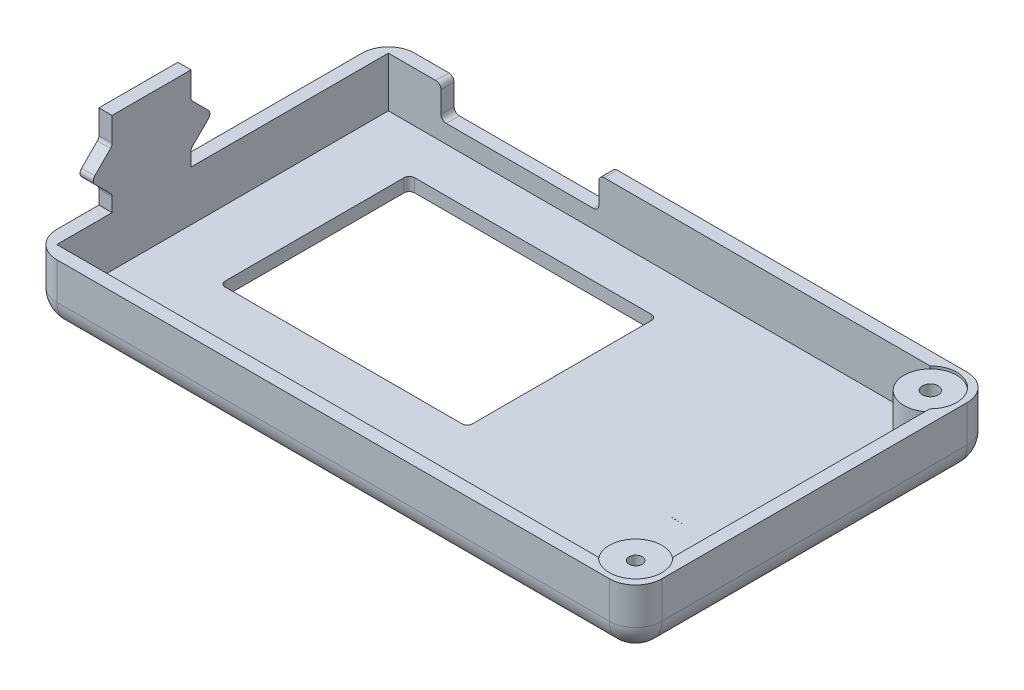
from build123d import *

# Parameters (mm, degrees)
SKETCH1_W           = 115
SKETCH1_H           = 68
BOSS_EXTRUDE1_DEPTH = 28
SHELL2_T            = -2.5
CUT_EXTRUDE8_DEPTH  = 124.146254511
CUT_EXTRUDE9_REACH  = 125.146
SKETCH10_W          = 26.217499217
SKETCH10_H          = 23
FILLET3_R           = 5
FILLET4_R           = 1
SKETCH11_R          = 5
BOSS_EXTRUDE3_DEPTH = 9.5
SKETCH12_R          = 5
CUT_EXTRUDE10_DEPTH = 0.5
SKETCH13_R          = 1.25
CUT_EXTRUDE11_DEPTH = 69.807703057
SKETCH15_R          = 1.5
CUT_EXTRUDE12_DEPTH = 69.80770319
CUT_EXTRUDE13_DEPTH = 73.431001776
SKETCH18_W          = 30
SKETCH18_H          = 6.061530508
CUT_EXTRUDE14_DEPTH = 2.5
FILLET5_R           = 1


with BuildPart() as part:
    # Sketch1 → Boss-Extrude1 (new body)
    with BuildSketch(Plane(origin=(0, 0, 0), x_dir=(1, 0, 0), z_dir=(0, 1, 0))):
        Rectangle(SKETCH1_W, SKETCH1_H)
    extrude(amount=BOSS_EXTRUDE1_DEPTH)

    # Shell2
    shell2_openings = [part.faces().sort_by_distance(p)[0] for p in [
        (0, 28, 0),
    ]]
    offset(amount=SHELL2_T, openings=shell2_openings, kind=Kind.INTERSECTION)

    # Sketch9 → Cut-Extrude8 (cut, through all)
    with BuildSketch(Plane.ZY.offset(57.5)):
        Polygon((-34, 12), (6, 12), (6, 15), (2, 19), (6, 23), (6, 28), (21, 28), (21, 23), (25, 19), (21, 15), (21, 12), (34, 12), (34, 34), (-34, 34), align=None)
    extrude(amount=-CUT_EXTRUDE8_DEPTH, mode=Mode.SUBTRACT)

    # Sketch10 → Cut-Extrude9 (cut, up to next)
    with BuildSketch(Plane(origin=(57.5, 0, 0), x_dir=(0, 0, -1), z_dir=(1, 0, 0)), mode=Mode.PRIVATE) as cut_extrude9_sk1:
        with Locations((-11.882996399, 23.5)):
            Rectangle(SKETCH10_W, SKETCH10_H)
    cut_extrude9_tool1 = extrude(cut_extrude9_sk1.sketch, amount=-CUT_EXTRUDE9_REACH, mode=Mode.PRIVATE) & part.part
    add(cut_extrude9_tool1.solids().sort_by_distance((57.5, 23.5, 11.882996))[0], mode=Mode.SUBTRACT)


with BuildPart() as cut_extrude9_piece_1:
    # of the separate pieces the step leaves, piece 1, a body of its own (cut_extrude9_pieces)
    add(part.part.solids().sort_by_distance((-57.5, 0, 34))[0])

    # Fillet3
    fillet3_edges = [cut_extrude9_piece_1.edges().sort_by_distance(p)[0] for p in [
        (57.5, 6, 34),
        (57.5, 0, 0),
        (57.5, 6, -34),
        (0, 0, -34),
        (-57.5, 6, -34),
        (-57.5, 0, 0),
        (-57.5, 6, 34),
        (0, 0, 34),
    ]]
    fillet(fillet3_edges, radius=FILLET3_R)

    # Fillet4
    fillet4_edges = [cut_extrude9_piece_1.edges().sort_by_distance(p)[0] for p in [
        (-56.25, 23, 21),
        (-56.25, 19, 25),
        (-56.25, 15, 21),
        (-56.25, 23, 6),
        (-56.25, 19, 2),
        (-56.25, 15, 6),
    ]]
    fillet(fillet4_edges, radius=FILLET4_R)

    # Sketch11 → Boss-Extrude3 (add)
    with BuildSketch(Plane(origin=(0, 2.5, 0), x_dir=(1, 0, 0), z_dir=(0, 1, 0))):
        with Locations((51.5, 28)):
            Circle(SKETCH11_R)
        with Locations((51.5, -28)):
            Circle(SKETCH11_R)
    extrude(amount=BOSS_EXTRUDE3_DEPTH)

    # Sketch12 → Cut-Extrude10 (cut)
    with BuildSketch(Plane(origin=(0, 12, 0), x_dir=(1, 0, 0), z_dir=(0, 1, 0))):
        with Locations((51.5, 28)):
            Circle(SKETCH12_R)
        with Locations((51.5, -28)):
            Circle(SKETCH12_R)
    extrude(amount=-CUT_EXTRUDE10_DEPTH, mode=Mode.SUBTRACT)

    # Sketch13 → Cut-Extrude11 (cut, through all)
    with BuildSketch(Plane(origin=(0, 11.5, 0), x_dir=(1, 0, 0), z_dir=(0, 1, 0))):
        with Locations(Location((51.5, -28, 0), (0, 0, 270))):
            Circle(SKETCH13_R)
    extrude(amount=-CUT_EXTRUDE11_DEPTH, mode=Mode.SUBTRACT)

    # Sketch15 → Cut-Extrude12 (cut, through all)
    with BuildSketch(Plane(origin=(0, 11.5, 0), x_dir=(1, 0, 0), z_dir=(0, 1, 0))):
        with Locations(Location((51.5, 28, 0), (0, 0, 270))):
            Circle(SKETCH15_R)
    extrude(amount=-CUT_EXTRUDE12_DEPTH, mode=Mode.SUBTRACT)

    # Sketch17 → Cut-Extrude13 (cut, through all)
    with BuildSketch(Plane.XZ):
        with BuildLine():
            Line((-41.5, 13), (3.5, 13))
            ThreePointArc((3.5, 13), (4.207106781, 12.707106781), (4.5, 12))
            Line((4.5, 12), (4.5, -22))
            ThreePointArc((4.5, -22), (4.207106781, -22.707106781), (3.5, -23))
            Line((3.5, -23), (-41.5, -23))
            ThreePointArc((-41.5, -23), (-42.207106781, -22.707106781), (-42.5, -22))
            Line((-42.5, -22), (-42.5, 12))
            ThreePointArc((-42.5, 12), (-42.207106781, 12.707106781), (-41.5, 13))
        make_face()
    extrude(amount=-CUT_EXTRUDE13_DEPTH, mode=Mode.SUBTRACT)

    # Sketch18 → Cut-Extrude14 (cut)
    with BuildSketch(Plane(origin=(0, 0, -34), x_dir=(-1, 0, 0), z_dir=(0, 0, -1))):
        with Locations((30, 8.969234746)):
            Rectangle(SKETCH18_W, SKETCH18_H)
    extrude(amount=-CUT_EXTRUDE14_DEPTH, mode=Mode.SUBTRACT)

    # Fillet5
    fillet5_edges = [cut_extrude9_piece_1.edges().sort_by_distance(p)[0] for p in [
        (-15, 5.938469492, -32.75),
        (-15, 12, -32.75),
        (-45, 12, -32.75),
        (-45, 5.938469492, -32.75),
    ]]
    fillet(fillet5_edges, radius=FILLET5_R)


with BuildPart() as cut_extrude9_piece_2:
    # of the separate pieces the step leaves, piece 2, a body of its own (cut_extrude9_pieces)
    add(part.part.solids().sort_by_distance((57.5, 19.008253993, 24.991746007))[0])


solid = Compound([cut_extrude9_piece_1.part, cut_extrude9_piece_2.part])
